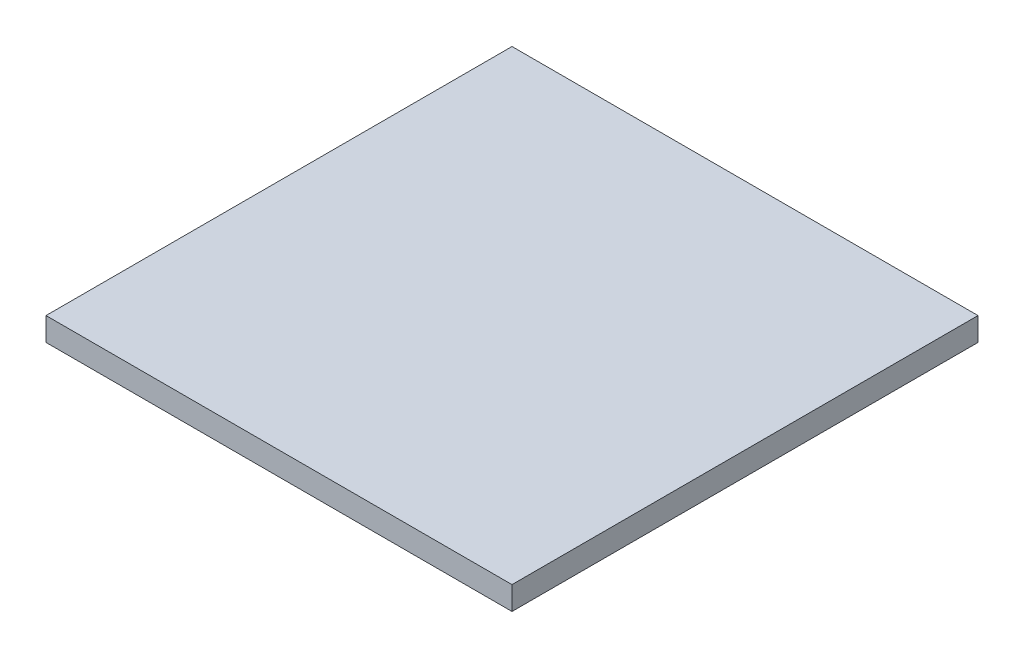
from build123d import *

# Parameters (mm, degrees)
SKETCH1_W   = 30
SKETCH1_H   = 30
BOARD_DEPTH = 1.5


with BuildPart() as part:
    # Sketch1 → Board (new body)
    with BuildSketch(Plane(origin=(0, 0, 0), x_dir=(1, 0, 0), z_dir=(0, 1, 0))):
        with Locations((15, 15)):
            Rectangle(SKETCH1_W, SKETCH1_H)
    extrude(amount=BOARD_DEPTH)


solid = part.part
